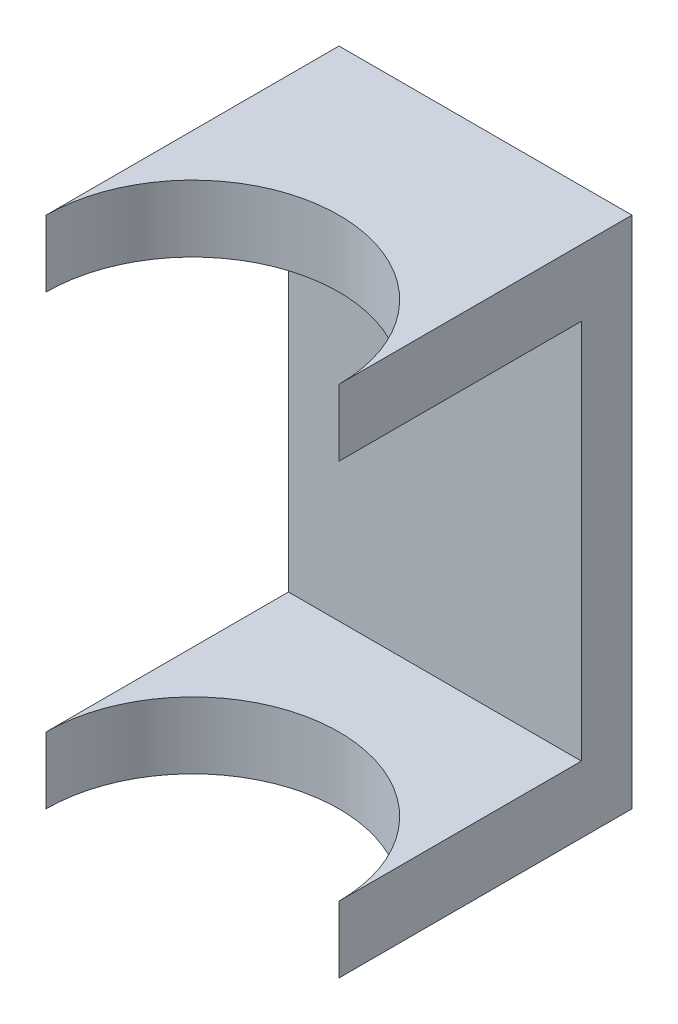
from build123d import *

# Parameters (mm, degrees)
SKETCH1_W           = 59.182
SKETCH1_H           = 59.182
BOSS_EXTRUDE2_DEPTH = 103.886
SKETCH4_R           = 29.591
CUT_EXTRUDE1_DEPTH  = 119.540559012
SKETCH6_W           = 59.182
SKETCH6_H           = 76.962
CUT_EXTRUDE2_DEPTH  = 129.342082086
SKETCH8_W           = 59.182
SKETCH8_H           = 10.20581791
BOSS_EXTRUDE3_DEPTH = 76.962


with BuildPart() as part:
    # Sketch1 → Boss-Extrude2 (new body)
    with BuildSketch(Plane(origin=(0, 0, 0), x_dir=(1, 0, 0), z_dir=(0, 1, 0))):
        with Locations((-17.066045707, -3.313152031)):
            Rectangle(SKETCH1_W, SKETCH1_H)
    extrude(amount=BOSS_EXTRUDE2_DEPTH)

    # Sketch4 → Cut-Extrude1 (cut, through all)
    with BuildSketch(Plane.XZ):
        with Locations((-17.066045707, 32.904152031)):
            Circle(SKETCH4_R)
    extrude(amount=-CUT_EXTRUDE1_DEPTH, mode=Mode.SUBTRACT)

    # Sketch6 → Cut-Extrude2 (cut, through all)
    with BuildSketch(Plane(origin=(0, 0, -26.277847969), x_dir=(-1, 0, 0), z_dir=(0, 0, -1))):
        with Locations((17.066045707, 51.943)):
            Rectangle(SKETCH6_W, SKETCH6_H)
    extrude(amount=-CUT_EXTRUDE2_DEPTH, mode=Mode.SUBTRACT)


with BuildPart() as cut_extrude2_piece_1:
    # of the separate pieces the step leaves, piece 1, a body of its own (cut_extrude2_pieces)
    add(part.part.solids().sort_by_distance((12.524954293, 90.424, -26.277847969))[0])



with BuildPart() as cut_extrude2_piece_2:
    # of the separate pieces the step leaves, piece 2, a body of its own (cut_extrude2_pieces)
    add(part.part.solids().sort_by_distance((-46.657045707, 0, -26.277847969))[0])


with BuildPart() as cut_extrude2_piece_1_1:
    add(cut_extrude2_piece_1.part)

    add(cut_extrude2_piece_2.part)  # Boss-Extrude3 merges Cut-Extrude2 piece 2
    # Sketch8 → Boss-Extrude3 (add)
    with BuildSketch(Plane.XZ.offset(-90.424)):
        with Locations((-17.066045707, -21.174939014)):
            Rectangle(SKETCH8_W, SKETCH8_H)
    extrude(amount=BOSS_EXTRUDE3_DEPTH)


solid = cut_extrude2_piece_1_1.part
